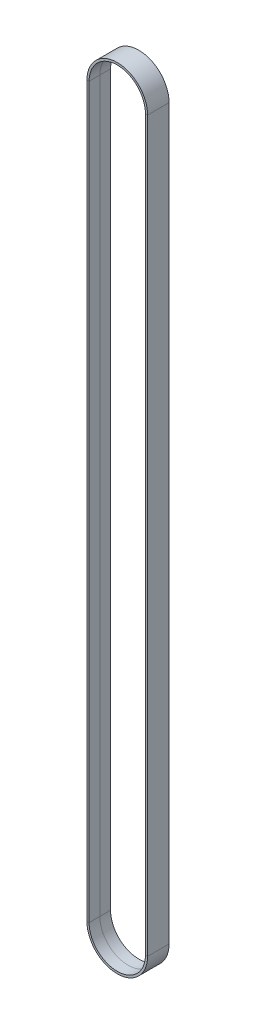
from build123d import *


with BuildPart() as part:
    # По траектории1: sweep along a path in Эскиз3
    with BuildLine(Plane.XY) as sweep_1_path:
        Line((-26.25, -678.678709755), (-26.25, 0))
        ThreePointArc((-26.25, 0), (0, 26.25), (26.25, 0))
        Line((26.25, 0), (26.25, -678.678709755))
        ThreePointArc((26.25, -678.678709755), (0, -704.928709755), (-26.25, -678.678709755))
    # Эскиз4 → По траектории1 (sweep)
    with BuildSketch(Plane(origin=(0, 0, 0), x_dir=(1, 0, 0), z_dir=(0, 1, 0))):
        Polygon((26.25, 0), (26.25, -10), (28.25, -10), (28.25, 10), (26.25, 10), align=None)
    sweep(path=sweep_1_path.line)


solid = part.part
